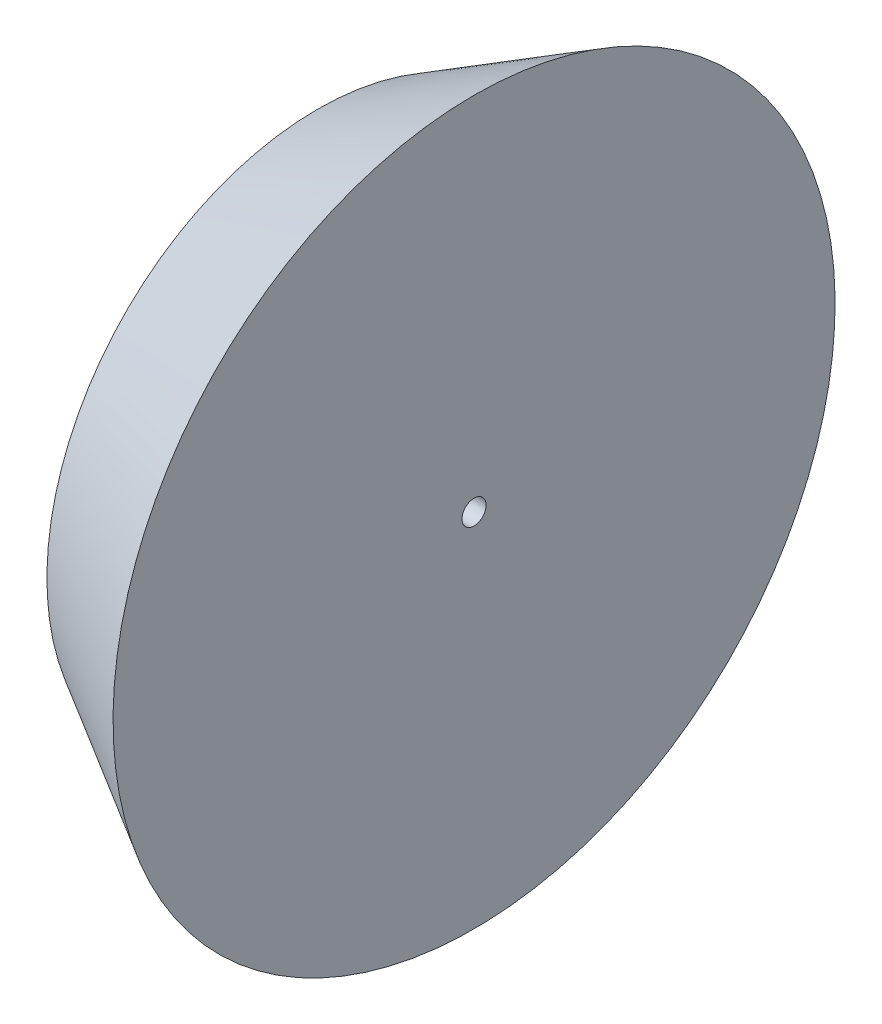
from build123d import *

# Parameters (mm, degrees)
SKETCH3_R          = 6.35
CUT_EXTRUDE1_DEPTH = 82.55


with BuildPart() as part:
    # Sketch2 → Revolve1 (revolve)
    with BuildSketch(Plane.XY):
        Polygon((0, 0), (0, 142.839735278), (82.55, 190.5), (82.55, 0), align=None)
    revolve(axis=Axis((82.55, 0, 0), (-1, 0, 0)))

    # Sketch3 → Cut-Extrude1 (cut)
    with BuildSketch(Plane.ZY):
        with Locations(Location((0, 0, 0), (0, 0, 270))):
            Circle(SKETCH3_R)
    extrude(amount=-CUT_EXTRUDE1_DEPTH, mode=Mode.SUBTRACT)


solid = part.part
